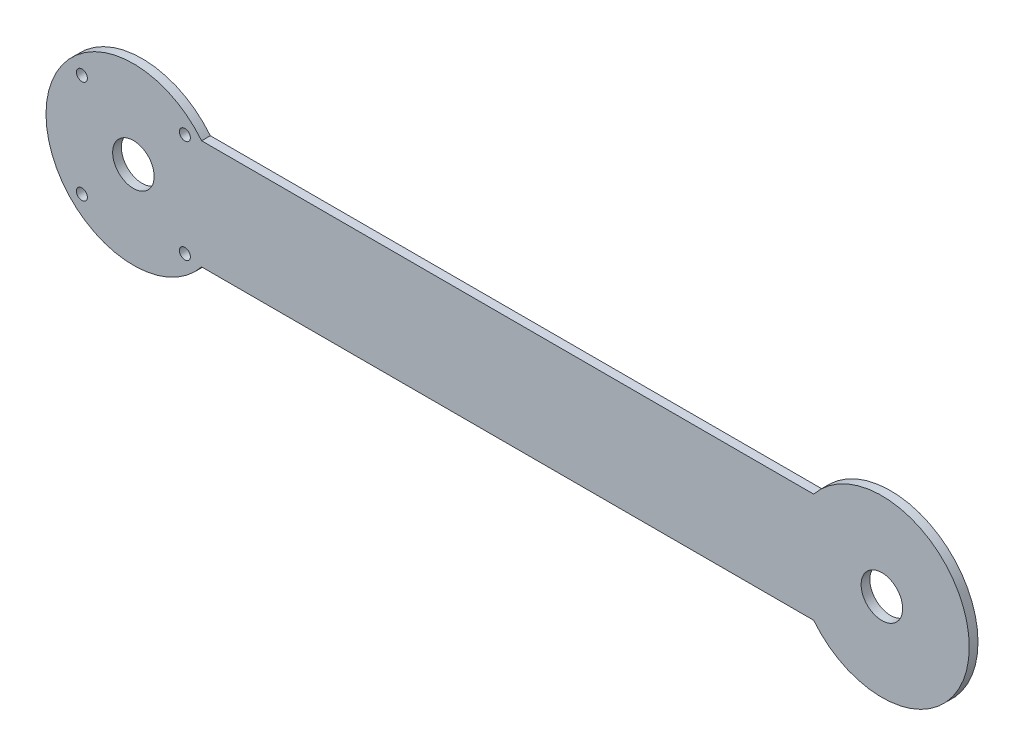
from build123d import *

# Parameters (mm, degrees)
SKETCH_1_R      = 2.5
SKETCH_1_R_2    = 9.5
EXTRUDE_1_DEPTH = 4


with BuildPart() as part:
    # 草图1 → 凸台-拉伸1 (new body)
    with BuildSketch(Plane.XY):
        with BuildLine():
            Line((31.224989992, 25), (311.341198994, 25))
            ThreePointArc((311.341198994, 25), (382.566188986, 0), (311.341198994, -25))
            Line((311.341198994, -25), (31.224989992, -25))
            ThreePointArc((31.224989992, -25), (-40, 0), (31.224989992, 25))
        make_face()
        with Locations((-23.57, 23.57)):
            Circle(SKETCH_1_R, mode=Mode.SUBTRACT)
        with Locations((23.57, 23.57)):
            Circle(SKETCH_1_R, mode=Mode.SUBTRACT)
        with Locations((23.57, -23.57)):
            Circle(SKETCH_1_R, mode=Mode.SUBTRACT)
        with Locations((-23.57, -23.57)):
            Circle(SKETCH_1_R, mode=Mode.SUBTRACT)
        with Locations((342.566188986, 0)):
            Circle(SKETCH_1_R_2, mode=Mode.SUBTRACT)
        Circle(SKETCH_1_R_2, mode=Mode.SUBTRACT)
    extrude(amount=EXTRUDE_1_DEPTH)


solid = part.part
